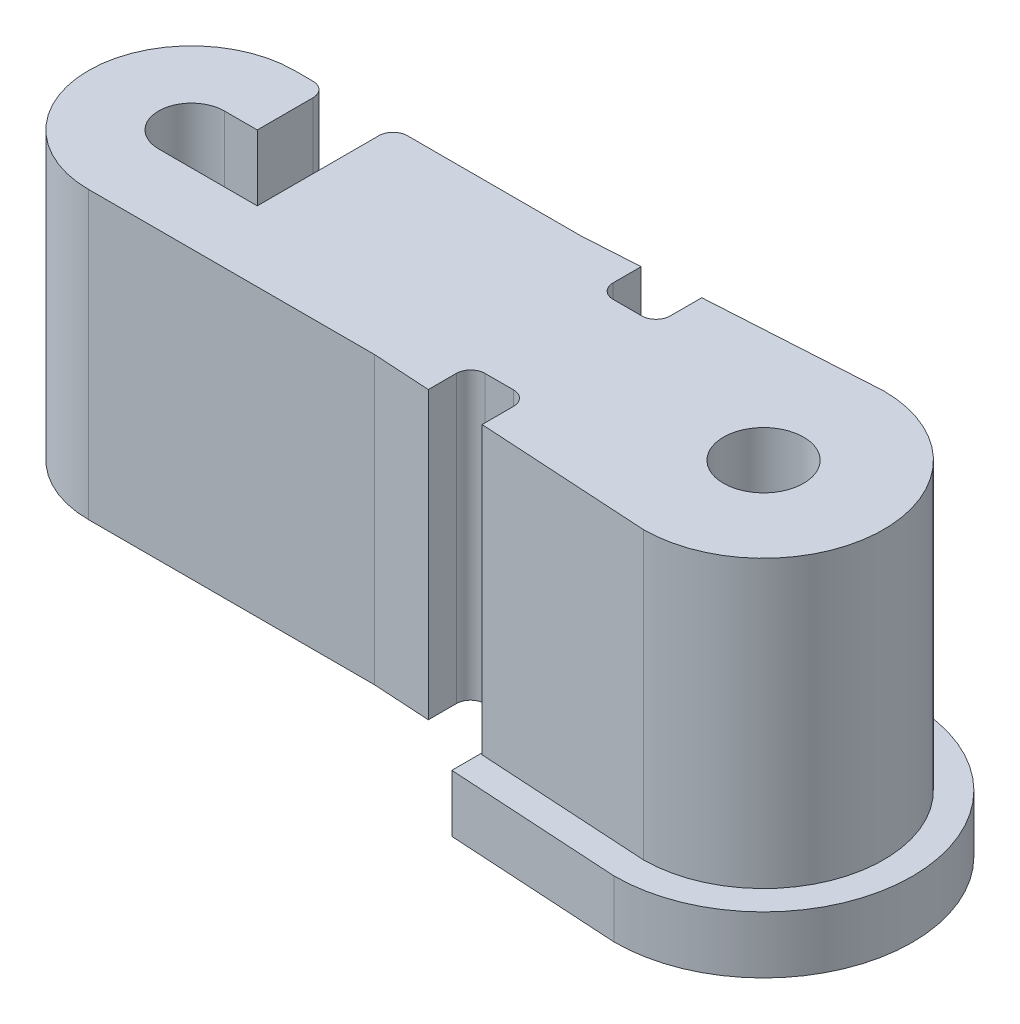
from build123d import *

# Parameters (mm, degrees)
BOSS_EXTRUDE1_DEPTH = 2.5
SKETCH4_R           = 0.35
THROUGH_HOLES_DEPTH = 7.493265742
FILLET1_R           = 0.125
SKETCH5_R           = 0.125
BOSS_EXTRUDE2_DEPTH = 0.5


with BuildPart() as part:
    # Sketch3 → Boss-Extrude1 (new body)
    with BuildSketch(Plane(origin=(0, 0, 0), x_dir=(1, 0, 0), z_dir=(0, 1, 0))):
        with BuildLine():
            Line((-2.5, 0.9), (-2, 0.93))
            Line((-2, 0.93), (-2, 0.56))
            Line((-2, 0.56), (-1.5, 0.56))
            Line((-1.5, 0.56), (-1.5, 0.96))
            Line((-1.5, 0.96), (0, 1.05))
            ThreePointArc((0, 1.05), (1.05, 0), (0, -1.05))
            Line((0, -1.05), (-1.5, -0.96))
            Line((-1.5, -0.96), (-1.5, -0.56))
            Line((-1.5, -0.56), (-2, -0.56))
            Line((-2, -0.56), (-2, -0.93))
            Line((-2, -0.93), (-2.5, -0.9))
            Line((-2.5, -0.9), (-5, -0.9))
            ThreePointArc((-5, -0.9), (-5.9, 0), (-5, 0.9))
            Line((-5, 0.9), (-2.5, 0.9))
        make_face()
    extrude(amount=BOSS_EXTRUDE1_DEPTH)

    # Sketch4 → Through Holes (cut, through all)
    with BuildSketch(Plane(origin=(0, 2.5, 0), x_dir=(1, 0, 0), z_dir=(0, 1, 0))):
        with BuildLine():
            Line((-4.1375, 0.9), (-4.7125, 0.9))
            Line((-4.7125, 0.9), (-4.7125, 0.2875))
            Line((-4.7125, 0.2875), (-5, 0.2875))
            ThreePointArc((-5, 0.2875), (-5.2875, 0), (-5, -0.2875))
            Line((-5, -0.2875), (-4.1375, -0.2875))
            Line((-4.1375, -0.2875), (-4.1375, 0.9))
        make_face()
        with Locations(Location((0, 0, 0), (0, 0, 270))):
            Circle(SKETCH4_R)
    extrude(amount=-THROUGH_HOLES_DEPTH, mode=Mode.SUBTRACT)

    # Fillet1
    fillet1_edges = [part.edges().sort_by_distance(p)[0] for p in [
        (-2, 1.25, 0.56),
        (-1.5, 1.25, 0.56),
        (-1.5, 1.25, -0.56),
        (-2, 1.25, -0.56),
        (-4.7125, 1.25, -0.9),
        (-4.1375, 1.25, -0.9),
    ]]
    fillet(fillet1_edges, radius=FILLET1_R)

    # Sketch5 → Boss-Extrude2 (add)
    with BuildSketch(Plane(origin=(0, 0, 0), x_dir=(1, 0, 0), z_dir=(0, 1, 0))):
        with BuildLine():
            Line((-1.514973073, -1.209551211), (-1.514973073, 1.209551211))
            Line((-1.514973073, 1.209551211), (-0.007892579, 1.299976041))
            ThreePointArc((-0.007892579, 1.299976041), (1.3, 0), (-0.007892579, -1.299976041))
            Line((-0.007892579, -1.299976041), (-1.514973073, -1.209551211))
        make_face()
        with Locations(Location((0, 0, 0), (0, 0, 270))):
            Circle(SKETCH5_R, mode=Mode.SUBTRACT)
    extrude(amount=-BOSS_EXTRUDE2_DEPTH)


solid = part.part
